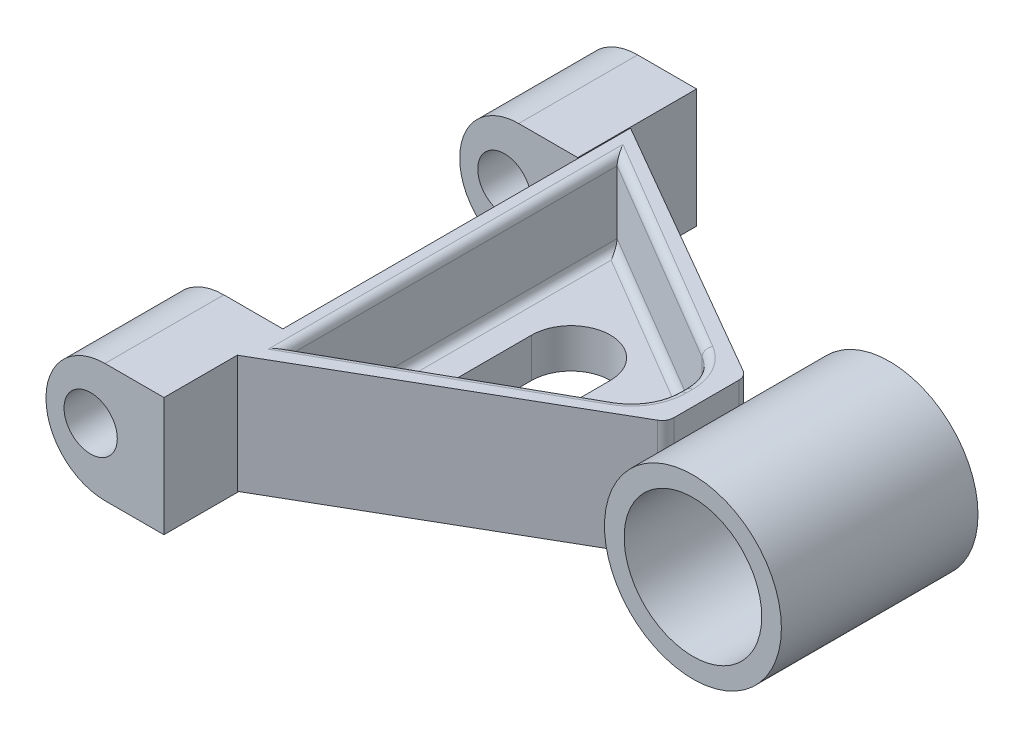
from build123d import *

# Parameters (mm, degrees)
BOSS_EXTRUDE1_DEPTH = 76.2
CUT_EXTRUDE1_DEPTH  = 101.6
SKETCH4_R           = 38.311860733
CUT_EXTRUDE2_DEPTH  = 50.8
FILLET1_R           = 10.16
SKETCH5_R           = 114.3
SKETCH5_R_2         = 88.9
BOSS_EXTRUDE2_DEPTH = 127
FILLET2_R           = 15.24
SKETCH7_W           = 153.582797675
SKETCH7_H           = 153.582797675
BOSS_EXTRUDE3_DEPTH = 152.4
SKETCH8_R           = 34.418137162
CUT_EXTRUDE3_DEPTH  = 778.002
FILLET3_R           = 76.2


with BuildPart() as part:
    # Sketch2 → Boss-Extrude1 (new, symmetric)
    with BuildSketch(Plane(origin=(0, 0, 0), x_dir=(1, 0, 0), z_dir=(0, 1, 0))):
        Polygon((351.952724098, -46.067080745), (351.952724098, 55.532919255), (0, 258.732919255), (0, -249.267080745), align=None)
    extrude(amount=BOSS_EXTRUDE1_DEPTH, both=True)

    # Sketch3 → Cut-Extrude1 (cut)
    with BuildSketch(Plane(origin=(0, 76.2, 0), x_dir=(1, 0, 0), z_dir=(0, 1, 0))):
        with BuildLine():
            Line((23.422147566, 217.912574818), (23.422147566, -205.276778605))
            Line((23.422147566, -205.276778605), (291.110294463, -54.746573984))
            ThreePointArc((291.110294463, -54.746573984), (313.849973398, -32.39028517), (322.190661125, -1.611565641))
            Line((322.190661125, -1.611565641), (322.190661125, 6.419861947))
            ThreePointArc((322.190661125, 6.419861947), (314.18370897, 36.620794448), (292.266241049, 58.888084508))
            Line((292.266241049, 58.888084508), (23.422147566, 217.912574818))
        make_face()
    extrude(amount=-CUT_EXTRUDE1_DEPTH, mode=Mode.SUBTRACT)

    # Sketch4 → Cut-Extrude2 (cut)
    with BuildSketch(Plane(origin=(0, -25.4, 0), x_dir=(1, 0, 0), z_dir=(0, 1, 0))):
        with Locations(Location((227.884419444, 0, 0), (0, 0, 270))):
            Circle(SKETCH4_R)
        with BuildLine():
            Line((167.655223077, 65.006150223), (167.655223077, -65.006150223))
            ThreePointArc((167.655223077, -65.006150223), (116.855223077, -115.806150223), (66.055223077, -65.006150223))
            Line((66.055223077, -65.006150223), (66.055223077, 65.006150223))
            ThreePointArc((66.055223077, 65.006150223), (116.855223077, 115.806150223), (167.655223077, 65.006150223))
        make_face()
    extrude(amount=-CUT_EXTRUDE2_DEPTH, mode=Mode.SUBTRACT)

    # Fillet1
    fillet1_edges = [part.edges().sort_by_distance(p)[0] for p in [
        (157.844194307, -25.4, -138.400329663),
        (314.18370897, -25.4, -36.620794448),
        (322.190661125, -25.4, -2.404148153),
        (313.849973398, -25.4, 32.39028517),
        (157.266221015, -25.4, 130.011676294),
        (23.422147566, -25.4, -6.317898106),
        (157.844194307, 76.2, -138.400329663),
        (23.422147566, 76.2, -6.317898106),
        (157.266221015, 76.2, 130.011676294),
        (313.849973398, 76.2, 32.39028517),
        (322.190661125, 76.2, -2.404148153),
        (314.18370897, 76.2, -36.620794448),
    ]]
    fillet(fillet1_edges, radius=FILLET1_R)

    # Fillet2
    fillet2_edges = [part.edges().sort_by_distance(p)[0] for p in [
        (351.952724098, 0, -55.532919255),
        (351.952724098, 0, 46.067080745),
    ]]
    fillet(fillet2_edges, radius=FILLET2_R)

    # Sketch7 → Boss-Extrude3 (add)
    with BuildSketch(Plane(origin=(0, 0, 0), x_dir=(0, 0, -1), z_dir=(1, 0, 0))):
        with Locations((-267.291398837, -0.591398838)):
            Rectangle(SKETCH7_W, SKETCH7_H)
        with Locations((267.291398837, 0.591398838)):
            Rectangle(SKETCH7_W, SKETCH7_H)
    extrude(amount=-BOSS_EXTRUDE3_DEPTH)

    # Sketch8 → Cut-Extrude3 (cut)
    with BuildSketch(Plane.XY.offset(344.082797675)):
        with Locations((-94.716643382, 0)):
            Circle(SKETCH8_R)
    extrude(amount=-CUT_EXTRUDE3_DEPTH, mode=Mode.SUBTRACT)

    # Fillet3
    fillet3_edges = [part.edges().sort_by_distance(p)[0] for p in [
        (-152.4, -77.382797675, 267.291398837),
        (-152.4, 76.2, 267.291398837),
        (-152.4, -76.2, -267.291398837),
        (-152.4, 77.382797675, -267.291398837),
    ]]
    fillet(fillet3_edges, radius=FILLET3_R)


with BuildPart() as body_2:
    # Sketch5 → Boss-Extrude2 (new, symmetric)
    with BuildSketch(Plane.XY):
        with Locations((466.358385684, 0)):
            Circle(SKETCH5_R)
        with Locations((466.358385684, 0)):
            Circle(SKETCH5_R_2, mode=Mode.SUBTRACT)
    extrude(amount=BOSS_EXTRUDE2_DEPTH, both=True)


solid = Compound([part.part, body_2.part])
